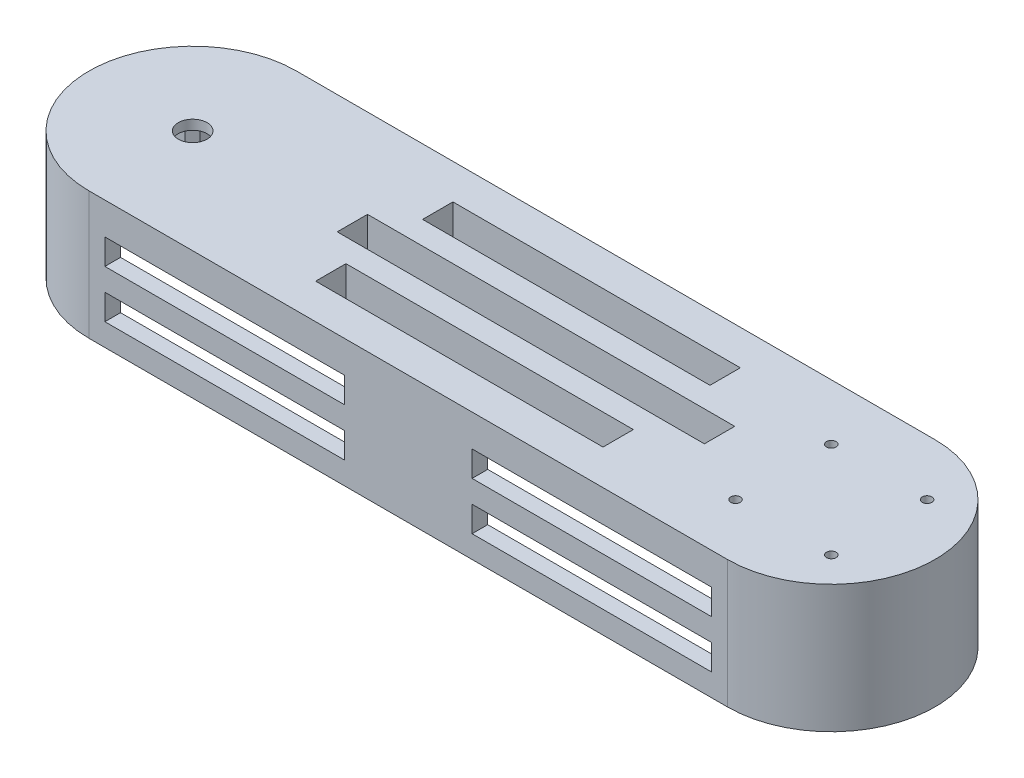
from build123d import *

# Parameters (mm, degrees)
SKETCH1_R           = 1.5
BOSS_EXTRUDE1_DEPTH = 10
BOSS_EXTRUDE2_START = -30
BOSS_EXTRUDE2_DEPTH = 30
SKETCH3_W           = 75
SKETCH3_H           = 8
CUT_EXTRUDE1_DEPTH  = 45
CUT_EXTRUDE2_DEPTH  = 7
SKETCH5_R           = 4.5
CUT_EXTRUDE3_DEPTH  = 10
CUT_EXTRUDE4_DEPTH  = 7


with BuildPart() as part:
    # Sketch1 → Boss-Extrude1 (new body)
    with BuildSketch(Plane(origin=(0, 0, 0), x_dir=(1, 0, 0), z_dir=(0, 1, 0))):
        with BuildLine():
            Line((-100, 32.5), (100, 32.5))
            ThreePointArc((100, 32.5), (132.5, 0), (100, -32.5))
            Line((100, -32.5), (-100, -32.5))
            ThreePointArc((-100, -32.5), (-132.5, 0), (-100, 32.5))
        make_face()
        with Locations(Location((85, 15, 0), (0, 0, 270))):
            Circle(SKETCH1_R, mode=Mode.SUBTRACT)
        with Locations(Location((115, 15, 0), (0, 0, 90))):
            Circle(SKETCH1_R, mode=Mode.SUBTRACT)
        with Locations(Location((85, -15, 0), (0, 0, 90))):
            Circle(SKETCH1_R, mode=Mode.SUBTRACT)
        with Locations(Location((115, -15, 0), (0, 0, 270))):
            Circle(SKETCH1_R, mode=Mode.SUBTRACT)
        Polygon((0, 21.5), (-40, 21.5), (-40, 12), (0, 12), (50, 12), (50, 21.5), align=None, mode=Mode.SUBTRACT)
        Polygon((-50, 4.75), (0, 4.75), (65, 4.75), (65, -4.75), (0, -4.75), (-50, -4.75), align=None, mode=Mode.SUBTRACT)
        Polygon((0, -12), (-40, -12), (-40, -21.5), (0, -21.5), (50, -21.5), (50, -12), align=None, mode=Mode.SUBTRACT)
    extrude(amount=BOSS_EXTRUDE1_DEPTH)

    # Sketch2 → Boss-Extrude2 (add)
    with BuildSketch(Plane(origin=(0, 0, 0), x_dir=(1, 0, 0), z_dir=(0, 1, 0)).offset(BOSS_EXTRUDE2_START)):
        with BuildLine():
            Line((-100, 32.5), (100, 32.5))
            ThreePointArc((100, 32.5), (132.5, 0), (100, -32.5))
            Line((100, -32.5), (-100, -32.5))
            ThreePointArc((-100, -32.5), (-132.5, 0), (-100, 32.5))
        make_face()
        with BuildLine():
            Line((99.668543355, 27.510998447), (-100, 27.510998447))
            ThreePointArc((-100, 27.510998447), (-127.55585262, -0.044854173), (-100, -27.600706793))
            Line((-100, -27.600706793), (100.998461852, -27.600706793))
            ThreePointArc((100.998461852, -27.600706793), (128.562336478, 0.636345006), (99.668543355, 27.510998447))
        make_face(mode=Mode.SUBTRACT)
    extrude(amount=BOSS_EXTRUDE2_DEPTH)

    # Sketch3 → Cut-Extrude1 (cut, symmetric)
    with BuildSketch(Plane.XY):
        with Locations((-57.5, -19)):
            Rectangle(SKETCH3_W, SKETCH3_H)
        with Locations((57.5, -19)):
            Rectangle(SKETCH3_W, SKETCH3_H)
        with Locations((57.5, -4)):
            Rectangle(SKETCH3_W, SKETCH3_H)
        with Locations((-57.5, -4)):
            Rectangle(SKETCH3_W, SKETCH3_H)
    extrude(amount=CUT_EXTRUDE1_DEPTH, both=True, mode=Mode.SUBTRACT)

    # Sketch4 → Cut-Extrude2 (cut)
    with BuildSketch(Plane(origin=(0, 0, 0), x_dir=(1, 0, 0), z_dir=(0, 1, 0))):
        Polygon((-102, 19), (-98, 19), (-95.5, 4.5), (-81, 2), (-81, -2), (-95.5, -4.5), (-98, -19), (-102, -19), (-104.5, -4.5), (-119, -2), (-119, 2), (-104.5, 4.5), align=None)
    extrude(amount=CUT_EXTRUDE2_DEPTH, mode=Mode.SUBTRACT)

    # Sketch5 → Cut-Extrude3 (cut)
    with BuildSketch(Plane(origin=(0, 0, 0), x_dir=(1, 0, 0), z_dir=(0, 1, 0))):
        with Locations(Location((-100, 0, 0), (0, 0, 90))):
            Circle(SKETCH5_R)
    extrude(amount=CUT_EXTRUDE3_DEPTH, mode=Mode.SUBTRACT)

    # Sketch7 → Cut-Extrude4 (cut)
    with BuildSketch(Plane.XZ):
        Polygon((-106.5, 4.155172414), (-106.5, -4.155172414), (-104.155172414, -6.5), (-95.844827586, -6.5), (-93.5, -4.155172414), (-93.5, 4.155172414), (-95.844827586, 6.5), (-104.155172414, 6.5), align=None)
    extrude(amount=-CUT_EXTRUDE4_DEPTH, mode=Mode.SUBTRACT)


solid = part.part
